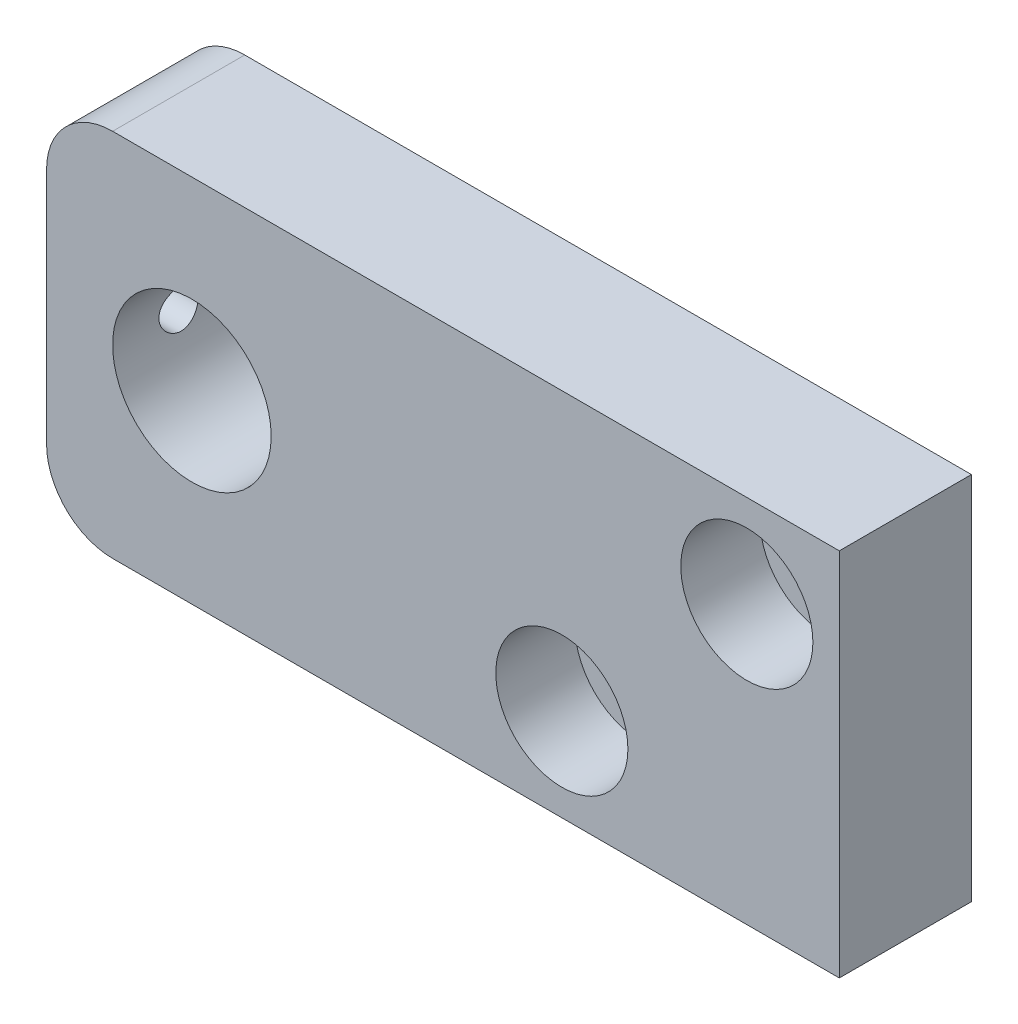
from build123d import *

# Parameters (mm, degrees)
IZIM1_R                     = 3
IZIM1_R_2                   = 6
Y_KSEKLIK_EKSTR_ZYON1_DEPTH = 10
KES_EKSTR_ZYON1_REACH       = 64.418
KES_EKSTR_ZYON1_END_RADIUS  = 6
IZIM2_R                     = 1.5
SKETCH1_R                   = 5
CUT_EXTRUDE1_DEPTH          = 6


with BuildPart() as part:
    # Çizim1 → Yükseklik-Ekstrüzyon1 (new body)
    with BuildSketch(Plane.XY):
        with BuildLine():
            Line((30, -14), (-25, -14))
            ThreePointArc((-25, -14), (-28.535533906, -12.535533906), (-30, -9))
            Line((-30, -9), (-30, 9))
            ThreePointArc((-30, 9), (-28.535533906, 12.535533906), (-25, 14))
            Line((-25, 14), (30, 14))
            Line((30, 14), (30, -14))
        make_face()
        with Locations((23, 7)):
            Circle(IZIM1_R, mode=Mode.SUBTRACT)
        with Locations((-19, 0)):
            Circle(IZIM1_R_2, mode=Mode.SUBTRACT)
        with Locations((9, -7)):
            Circle(IZIM1_R, mode=Mode.SUBTRACT)
    extrude(amount=Y_KSEKLIK_EKSTR_ZYON1_DEPTH)

    # Kes-Ekstrüzyon1: up to this cylinder (the profile starts outside it)
    kes_ekstr_zyon1_end = Plane(origin=(-19, 0, 5), z_dir=(0, 0, -1)) * Cylinder(KES_EKSTR_ZYON1_END_RADIUS, 141.836, mode=Mode.PRIVATE)
    # Çizim2 → Kes-Ekstrüzyon1 (cut, up to the surface)
    with BuildSketch(Plane.ZY.offset(30), mode=Mode.PRIVATE) as kes_ekstr_zyon1_sk1:
        with Locations((5, 0)):
            Circle(IZIM2_R)
    kes_ekstr_zyon1_tool1 = extrude(kes_ekstr_zyon1_sk1.sketch, amount=-KES_EKSTR_ZYON1_REACH, mode=Mode.PRIVATE) - kes_ekstr_zyon1_end
    add(kes_ekstr_zyon1_tool1.solids().sort_by_distance((-30, 0, 5))[0], mode=Mode.SUBTRACT)

    # Sketch1 → Cut-Extrude1 (cut)
    with BuildSketch(Plane.XY.offset(10)):
        with Locations((9, -7)):
            Circle(SKETCH1_R)
        with Locations((23, 7)):
            Circle(SKETCH1_R)
    extrude(amount=-CUT_EXTRUDE1_DEPTH, mode=Mode.SUBTRACT)


solid = part.part
